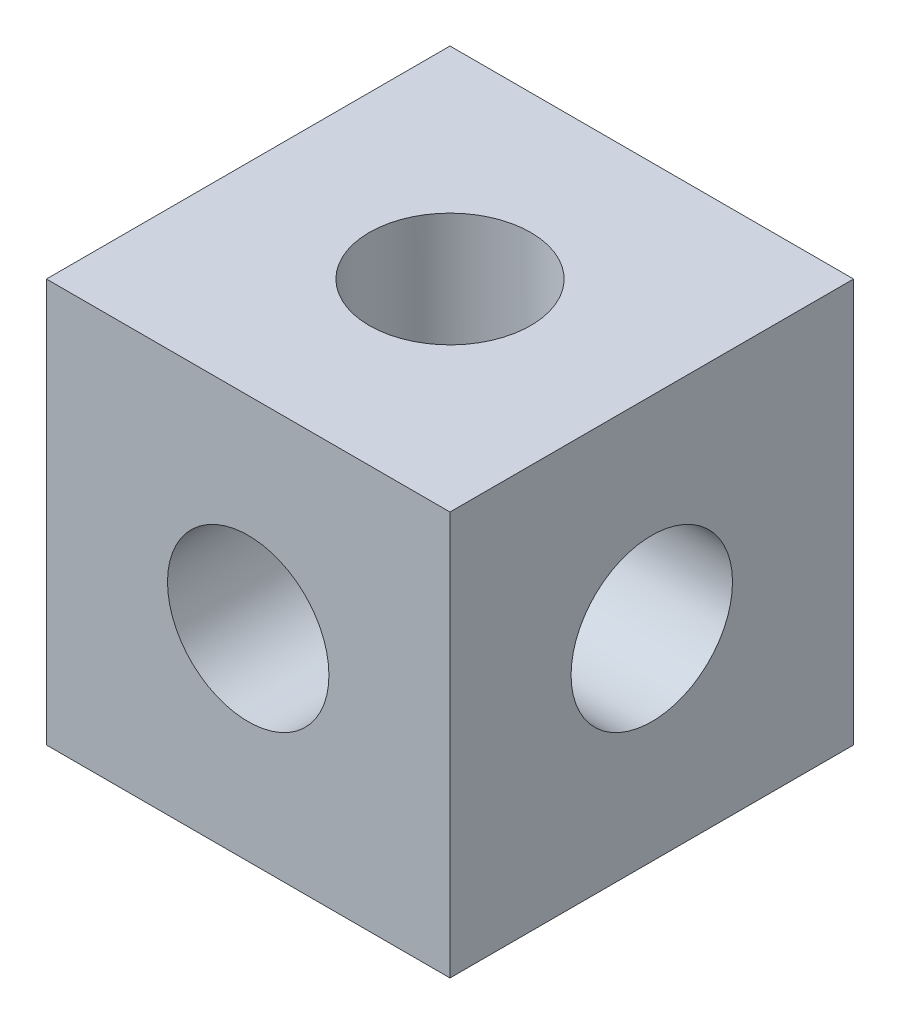
from build123d import *

# Parameters (mm, degrees)
SKETCH_1_W          = 10
SKETCH_1_H          = 10
SKETCH_1_R          = 2
EXTRUDE_1_DEPTH     = 10
SKETCH_2_R          = 2
CUT_EXTRUDE_1_DEPTH = 10
SKETCH_3_R          = 2
CUT_EXTRUDE_2_DEPTH = 10


with BuildPart() as part:
    # 草图1 → 凸台-拉伸1 (new body)
    with BuildSketch(Plane(origin=(0, 0, 0), x_dir=(1, 0, 0), z_dir=(0, 1, 0))):
        Rectangle(SKETCH_1_W, SKETCH_1_H)
        with Locations(Location((0, 0, 0), (0, 0, 270))):
            Circle(SKETCH_1_R, mode=Mode.SUBTRACT)
    extrude(amount=EXTRUDE_1_DEPTH)

    # 草图2 → 切除-拉伸1 (cut)
    with BuildSketch(Plane.XY.offset(5)):
        with Locations((0, 5)):
            Circle(SKETCH_2_R)
    extrude(amount=-CUT_EXTRUDE_1_DEPTH, mode=Mode.SUBTRACT)

    # 草图3 → 切除-拉伸2 (cut)
    with BuildSketch(Plane(origin=(5, 0, 0), x_dir=(0, 0, -1), z_dir=(1, 0, 0))):
        with Locations((0, 5)):
            Circle(SKETCH_3_R)
    extrude(amount=-CUT_EXTRUDE_2_DEPTH, mode=Mode.SUBTRACT)


solid = part.part
